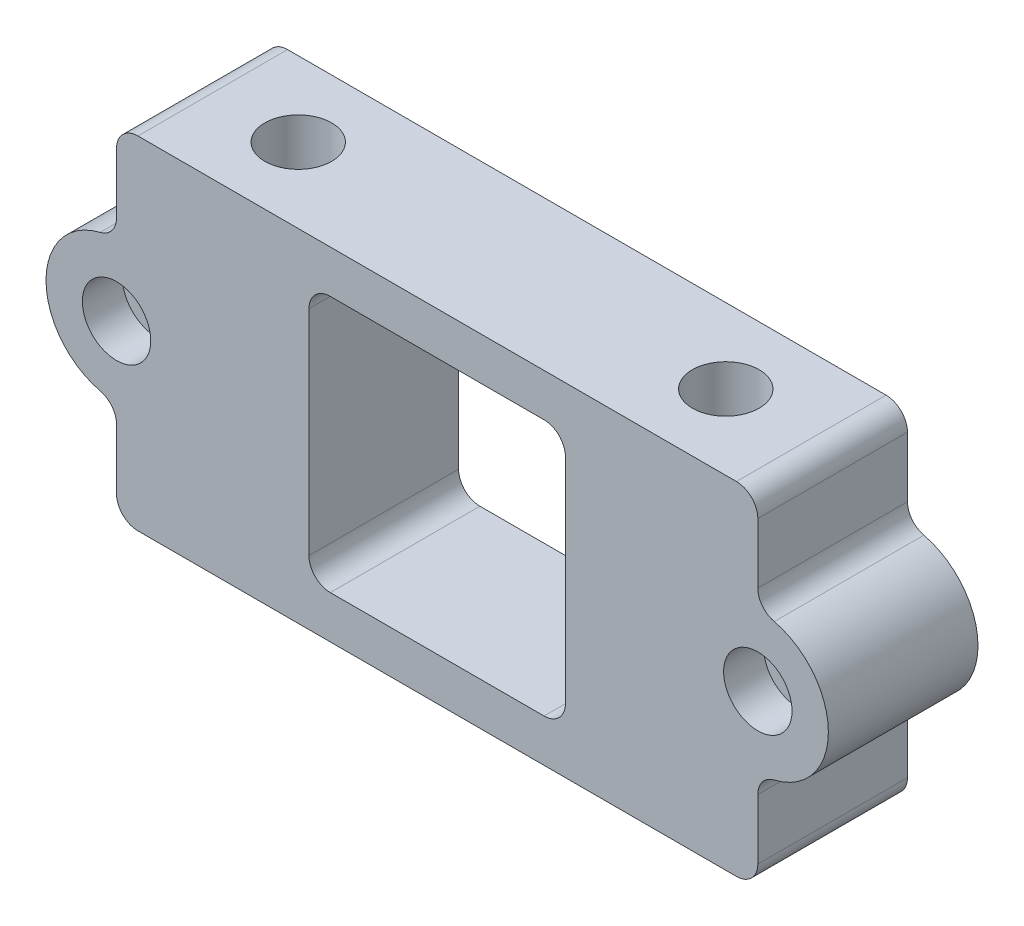
from build123d import *

# Parameters (mm, degrees)
SKETCH1_W           = 93.6625
SKETCH1_H           = 40.64
SKETCH1_R           = 2.4892
BOSS_EXTRUDE1_DEPTH = 17.78
SKETCH6_R           = 3.96875
CUT_EXTRUDE4_DEPTH  = 104.635910312
CUT_EXTRUDE3_DEPTH  = 17.78
FILLET1_R           = 2.54
SKETCH3_R           = 4.064
CUT_EXTRUDE5_DEPTH  = 4.7752
CUT_EXTRUDE6_DEPTH  = 98.141100599


with BuildPart() as part:
    # Sketch1 → Boss-Extrude1 (new body)
    with BuildSketch(Plane.XY):
        with Locations((-46.83125, 0)):
            Rectangle(SKETCH1_W, SKETCH1_H)
        with Locations((-84.93125, 0)):
            Circle(SKETCH1_R, mode=Mode.SUBTRACT)
        with Locations((-8.73125, 0)):
            Circle(SKETCH1_R, mode=Mode.SUBTRACT)
    extrude(amount=-BOSS_EXTRUDE1_DEPTH)

    # Sketch6 → Cut-Extrude4 (cut, through all)
    with BuildSketch(Plane(origin=(0, 20.32, 0), x_dir=(1, 0, 0), z_dir=(0, 1, 0))):
        with Locations(Location((-72.23125, 8.89, 0), (0, 0, 270))):
            Circle(SKETCH6_R)
        with Locations(Location((-21.43125, 8.89, 0), (0, 0, 270))):
            Circle(SKETCH6_R)
    extrude(amount=-CUT_EXTRUDE4_DEPTH, mode=Mode.SUBTRACT)

    # Sketch5 → Cut-Extrude3 (cut)
    with BuildSketch(Plane.XY):
        with BuildLine():
            Line((-93.6625, -20.32), (-93.6625, 20.32))
            Line((-93.6625, 20.32), (-84.93125, 20.32))
            Line((-84.93125, 20.32), (-84.93125, 10.622546022))
            ThreePointArc((-84.93125, 10.622546022), (-85.477262526, 9.049137635), (-86.880552326, 8.152186482))
            ThreePointArc((-86.880552326, 8.152186482), (-93.31325, 0), (-86.880552326, -8.152186482))
            ThreePointArc((-86.880552326, -8.152186482), (-85.477262526, -9.049137635), (-84.93125, -10.622546022))
            Line((-84.93125, -10.622546022), (-84.93125, -20.32))
            Line((-84.93125, -20.32), (-93.6625, -20.32))
        make_face()
        with BuildLine():
            Line((0, -20.32), (0, 20.32))
            Line((0, 20.32), (-8.73125, 20.32))
            Line((-8.73125, 20.32), (-8.73125, 10.622546022))
            ThreePointArc((-8.73125, 10.622546022), (-8.185237474, 9.049137635), (-6.781947674, 8.152186482))
            ThreePointArc((-6.781947674, 8.152186482), (-0.34925, 0), (-6.781947674, -8.152186482))
            ThreePointArc((-6.781947674, -8.152186482), (-8.185237474, -9.049137635), (-8.73125, -10.622546022))
            Line((-8.73125, -10.622546022), (-8.73125, -20.32))
            Line((-8.73125, -20.32), (0, -20.32))
        make_face()
    extrude(amount=-CUT_EXTRUDE3_DEPTH, mode=Mode.SUBTRACT)

    # Fillet1
    fillet1_edges = [part.edges().sort_by_distance(p)[0] for p in [
        (-84.93125, 20.32, -8.89),
        (-84.93125, -20.32, -8.89),
        (-8.73125, 20.32, -8.89),
        (-8.73125, -20.32, -8.89),
    ]]
    fillet(fillet1_edges, radius=FILLET1_R)

    # Sketch3 → Cut-Extrude5 (cut)
    with BuildSketch(Plane.XY):
        with Locations((-84.93125, 0)):
            Circle(SKETCH3_R)
        with Locations((-8.73125, 0)):
            Circle(SKETCH3_R)
    extrude(amount=-CUT_EXTRUDE5_DEPTH, mode=Mode.SUBTRACT)

    # Sketch7 → Cut-Extrude6 (cut, through all)
    with BuildSketch(Plane.XY):
        with BuildLine():
            Line((-59.53125, -15.24), (-34.13125, -15.24))
            ThreePointArc((-34.13125, -15.24), (-32.335198776, -14.496051224), (-31.59125, -12.7))
            Line((-31.59125, -12.7), (-31.59125, 12.7))
            ThreePointArc((-31.59125, 12.7), (-32.335198776, 14.496051224), (-34.13125, 15.24))
            Line((-34.13125, 15.24), (-59.53125, 15.24))
            ThreePointArc((-59.53125, 15.24), (-61.327301224, 14.496051224), (-62.07125, 12.7))
            Line((-62.07125, 12.7), (-62.07125, -12.7))
            ThreePointArc((-62.07125, -12.7), (-61.327301224, -14.496051224), (-59.53125, -15.24))
        make_face()
    extrude(amount=-CUT_EXTRUDE6_DEPTH, mode=Mode.SUBTRACT)


solid = part.part
